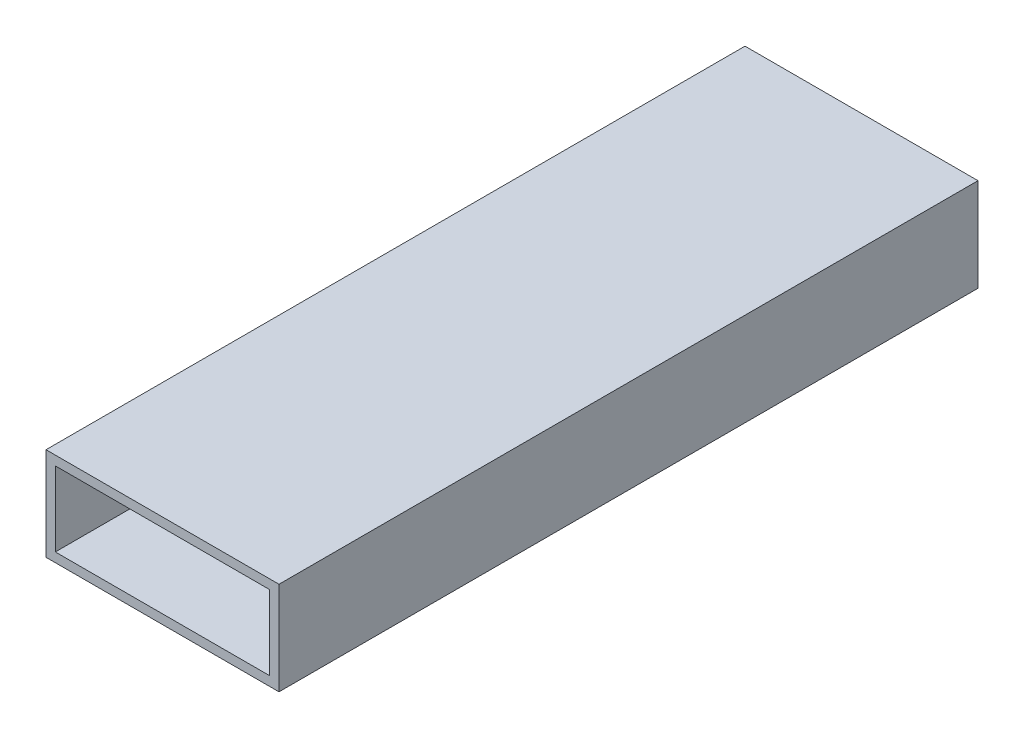
from build123d import *

# Parameters (mm, degrees)
SKICA1_W                = 50
SKICA1_H                = 20
P_IDAT_VYSUNUT_M1_DEPTH = 150
SKO_EPINA1_T            = -2


with BuildPart() as part:
    # Skica1 → Přidat vysunutím1 (new body)
    with BuildSketch(Plane.XY):
        with Locations((25, 10)):
            Rectangle(SKICA1_W, SKICA1_H)
    extrude(amount=P_IDAT_VYSUNUT_M1_DEPTH)

    # Skořepina1
    sko_epina1_openings = [part.faces().sort_by_distance(p)[0] for p in [
        (25, 10, 150),
        (25, 10, 0),
    ]]
    offset(amount=SKO_EPINA1_T, openings=sko_epina1_openings, kind=Kind.INTERSECTION)


solid = part.part
